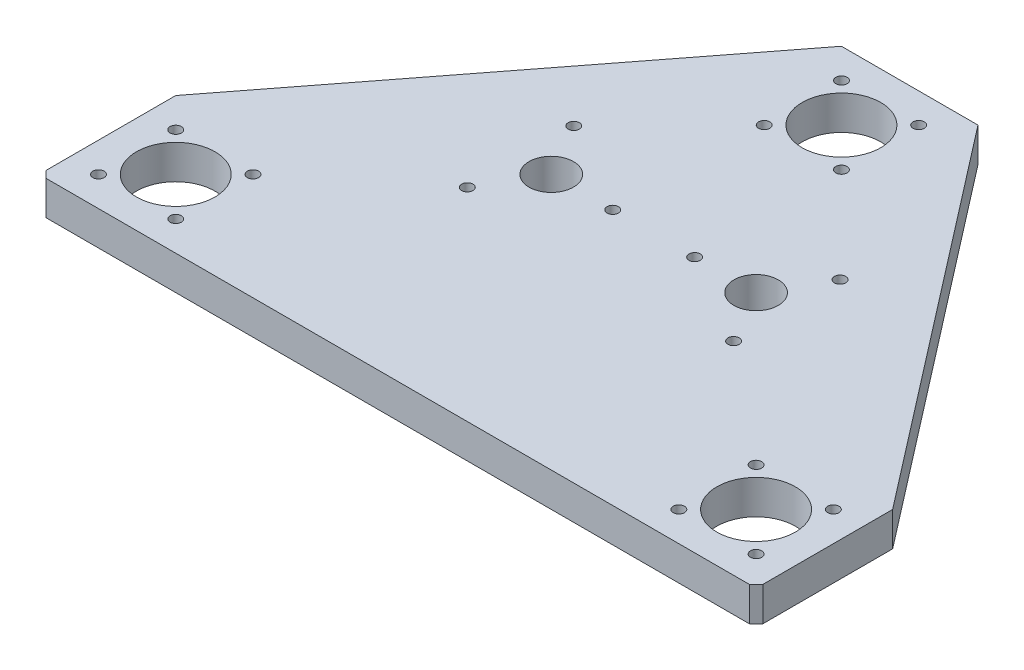
from build123d import *

# Parameters (mm, degrees)
SKETCH1_R             = 6.5
SKETCH1_R_2           = 11.5
BOSS_EXTRUDE1_DEPTH   = 10
CHAMFER1_SIZE         = 2
M4X0_7_TAPPED_HOLE1_D = 3.3
M4X0_7_TAPPED_HOLE2_D = 3.3
CIRPATTERN1_COUNT     = 3
MIRROR1_COPY_1_D      = 3.3
MIRROR1_COPY_2_D      = 3.3


with BuildPart() as part:
    # Sketch1 → Boss-Extrude1 (new body)
    with BuildSketch(Plane(origin=(0, 0, 0), x_dir=(1, 0, 0), z_dir=(0, 1, 0))):
        Polygon((-105, -35), (-20, 75), (20, 75), (105, -35), (105, -75), (65, -75), (-65, -75), (-105, -75), align=None)
        with Locations(Location((-30, 0, 0), (0, 0, 270))):
            Circle(SKETCH1_R, mode=Mode.SUBTRACT)
        with Locations(Location((30, 0, 0), (0, 0, 270))):
            Circle(SKETCH1_R, mode=Mode.SUBTRACT)
        with Locations(Location((0, 55, 0), (0, 0, 270))):
            Circle(SKETCH1_R_2, mode=Mode.SUBTRACT)
        with Locations(Location((85, -55, 0), (0, 0, 270))):
            Circle(SKETCH1_R_2, mode=Mode.SUBTRACT)
        with Locations(Location((-85, -55, 0), (0, 0, 270))):
            Circle(SKETCH1_R_2, mode=Mode.SUBTRACT)
    extrude(amount=BOSS_EXTRUDE1_DEPTH)

    # Chamfer1
    chamfer1_edges = [part.edges().sort_by_distance(p)[0] for p in [
        (105, 5, 75),
        (-105, 5, 75),
    ]]
    chamfer(chamfer1_edges, length=CHAMFER1_SIZE)

    # M4x0.7 Tapped Hole1 (through all)
    with Locations(Plane(origin=(-96.313708499, 10, 43.686291501), x_dir=(0, 0, 1), z_dir=(0, 1, 0))):
        with Locations((0, 0), (0, 22.627416998), (22.627416998, 22.627416998), (22.627416998, 0), (-87.372583002, 85), (-110, 85)):
            m4x0_7_tapped_hole1 = Hole(M4X0_7_TAPPED_HOLE1_D / 2)

    # M4x0.7 Tapped Hole2 (through all)
    with Locations(Plane(origin=(-12, 10, 0), x_dir=(0, 0, 1), z_dir=(0, 1, 0))):
        with Locations((0, 0)):
            m4x0_7_tapped_hole2 = Hole(M4X0_7_TAPPED_HOLE2_D / 2)

    # CirPattern1: M4x0.7 Tapped Hole2 ×3 about axis
    cirpattern1_axis = Axis((-30, 0, 0), (0, 1, 0))
    for i in range(1, CIRPATTERN1_COUNT):
        add(m4x0_7_tapped_hole2.rotate(cirpattern1_axis, i * 360 / CIRPATTERN1_COUNT), mode=Mode.SUBTRACT)

    # Mirror1: M4x0.7 Tapped Hole1, M4x0.7 Tapped Hole2 across plane
    add(m4x0_7_tapped_hole1.mirror(Plane(origin=(0, 0, 0), x_dir=(0, 0, 1), z_dir=(1, 0, 0))), mode=Mode.SUBTRACT)
    add(m4x0_7_tapped_hole2.mirror(Plane(origin=(0, 0, 0), x_dir=(0, 0, 1), z_dir=(1, 0, 0))), mode=Mode.SUBTRACT)

    # Mirror1 copy 1 (through all)
    with Locations(Plane(origin=(39, 10, -15.588457268), x_dir=(-0.8660254037844387, 0, -0.4999999999999998), z_dir=(0, 1, 0))):
        with Locations((0, 0)):
            Hole(MIRROR1_COPY_1_D / 2)

    # Mirror1 copy 2 (through all)
    with Locations(Plane(origin=(39, 10, 15.588457268), x_dir=(0.8660254037844384, 0, -0.5000000000000004), z_dir=(0, 1, 0))):
        with Locations((0, 0)):
            Hole(MIRROR1_COPY_2_D / 2)


solid = part.part
